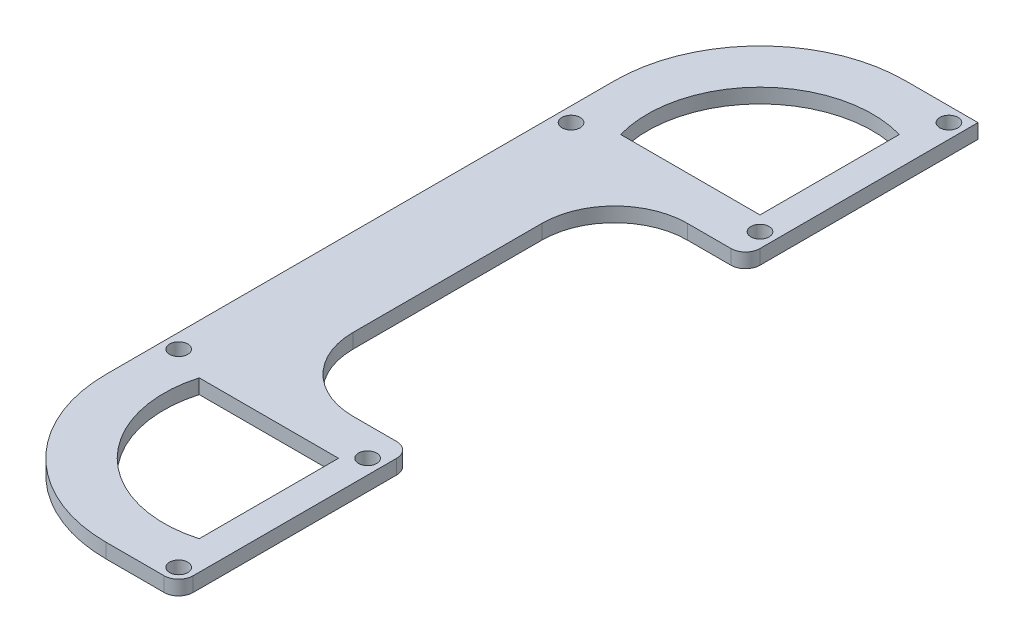
from build123d import *

# Parameters (mm, degrees)
SKETCH_1_W          = 30
SKETCH_1_H          = 110
EXTRUDE_1_DEPTH     = 2
SKETCH_2_R          = 1.25
CUT_EXTRUDE_1_DEPTH = 2
FILLET_1_R          = 20
FILLET_2_R          = 2
SKETCH_3_W          = 18
SKETCH_3_H          = 46
CUT_EXTRUDE_2_DEPTH = 2
FILLET_4_R          = 10
FILLET_5_R          = 2
CUT_EXTRUDE_3_DEPTH = 10


with BuildPart() as part:
    # 草图1 → 凸台-拉伸1 (new body)
    with BuildSketch(Plane(origin=(0, 0, 0), x_dir=(1, 0, 0), z_dir=(0, 1, 0))):
        Rectangle(SKETCH_1_W, SKETCH_1_H)
    extrude(amount=EXTRUDE_1_DEPTH)

    # 草图2 → 切除-拉伸1 (cut)
    with BuildSketch(Plane(origin=(0, 2, 0), x_dir=(1, 0, 0), z_dir=(0, 1, 0))):
        with Locations(Location((13, 27, 0), (0, 0, 270))):
            Circle(SKETCH_2_R)
        with Locations(Location((-13, 27, 0), (0, 0, 90))):
            Circle(SKETCH_2_R)
        with Locations(Location((13, 53, 0), (0, 0, 270))):
            Circle(SKETCH_2_R)
        with Locations(Location((13, -53, 0), (0, 0, 90))):
            Circle(SKETCH_2_R)
        with Locations(Location((-13, -27, 0), (0, 0, 270))):
            Circle(SKETCH_2_R)
        with Locations(Location((13, -27, 0), (0, 0, 90))):
            Circle(SKETCH_2_R)
    extrude(amount=-CUT_EXTRUDE_1_DEPTH, mode=Mode.SUBTRACT)

    # 圆角1
    fillet_1_edges = [part.edges().sort_by_distance(p)[0] for p in [
        (-15, 1, 55),
        (-15, 1, -55),
    ]]
    fillet(fillet_1_edges, radius=FILLET_1_R)

    # 圆角2
    fillet_2_edges = [part.edges().sort_by_distance(p)[0] for p in [
        (15, 1, 55),
    ]]
    fillet(fillet_2_edges, radius=FILLET_2_R)

    # 草图3 → 切除-拉伸2 (cut)
    with BuildSketch(Plane(origin=(0, 2, 0), x_dir=(1, 0, 0), z_dir=(0, 1, 0))):
        with Locations((6, 0)):
            Rectangle(SKETCH_3_W, SKETCH_3_H)
    extrude(amount=-CUT_EXTRUDE_2_DEPTH, mode=Mode.SUBTRACT)

    # 圆角4
    fillet_4_edges = [part.edges().sort_by_distance(p)[0] for p in [
        (-3, 1, -23),
        (-3, 1, 23),
    ]]
    fillet(fillet_4_edges, radius=FILLET_4_R)

    # 圆角5
    fillet_5_edges = [part.edges().sort_by_distance(p)[0] for p in [
        (15, 1, -23),
        (15, 1, 23),
    ]]
    fillet(fillet_5_edges, radius=FILLET_5_R)

    # 草图4 → 切除-拉伸3 (cut)
    with BuildSketch(Plane(origin=(0, 2, 0), x_dir=(1, 0, 0), z_dir=(0, 1, 0))):
        with BuildLine():
            Line((11, 48.171572875), (11, 29))
            Line((11, 29), (-8.171572875, 29))
            ThreePointArc((-8.171572875, 29), (-4.228384219, 44.228384219), (11, 48.171572875))
        make_face()
        with BuildLine():
            Line((11, -29), (-8.171572875, -29))
            ThreePointArc((-8.171572875, -29), (-4.228384219, -44.228384219), (11, -48.171572875))
            Line((11, -48.171572875), (11, -29))
        make_face()
    extrude(amount=-CUT_EXTRUDE_3_DEPTH, mode=Mode.SUBTRACT)


solid = part.part
